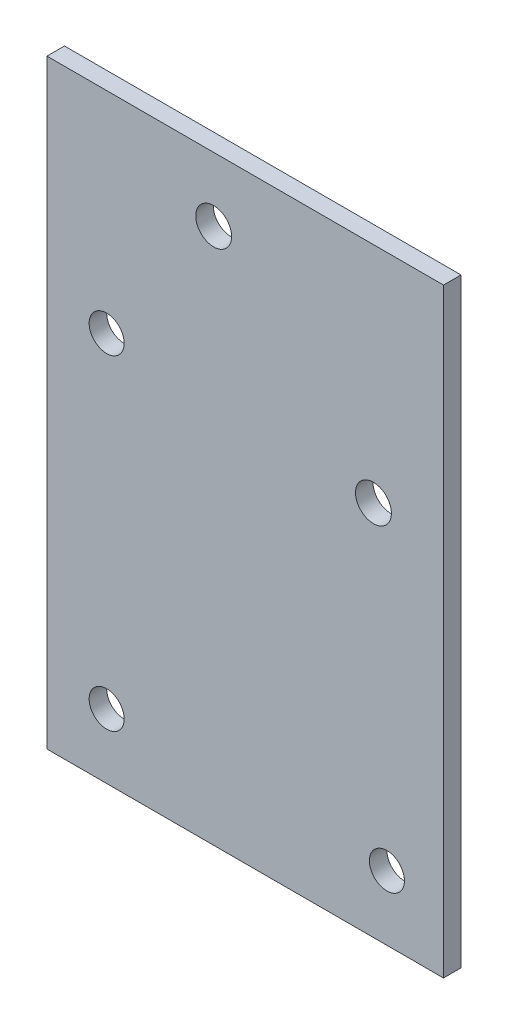
from build123d import *

# Parameters (mm, degrees)
SKETCH1_W           = 71.868504438
SKETCH1_H           = 108.769662743
SKETCH1_R           = 3.175
SKETCH1_R_2         = 3.2512
BOSS_EXTRUDE1_DEPTH = 3.175


with BuildPart() as part:
    # Sketch1 → Boss-Extrude1 (new body)
    with BuildSketch(Plane.XY):
        with Locations((-51.078931076, 219.572311485)):
            Rectangle(SKETCH1_W, SKETCH1_H)
        with Locations((-25.4, 176.892857143)):
            Circle(SKETCH1_R, mode=Mode.SUBTRACT)
        with Locations((-76.2, 176.892857143)):
            Circle(SKETCH1_R, mode=Mode.SUBTRACT)
        with Locations((-27.844678857, 233.404604576)):
            Circle(SKETCH1_R_2, mode=Mode.SUBTRACT)
        with Locations((-56.800678857, 262.360604576)):
            Circle(SKETCH1_R_2, mode=Mode.SUBTRACT)
        with Locations((-76.2, 235.857142857)):
            Circle(SKETCH1_R, mode=Mode.SUBTRACT)
    extrude(amount=BOSS_EXTRUDE1_DEPTH)


solid = part.part
